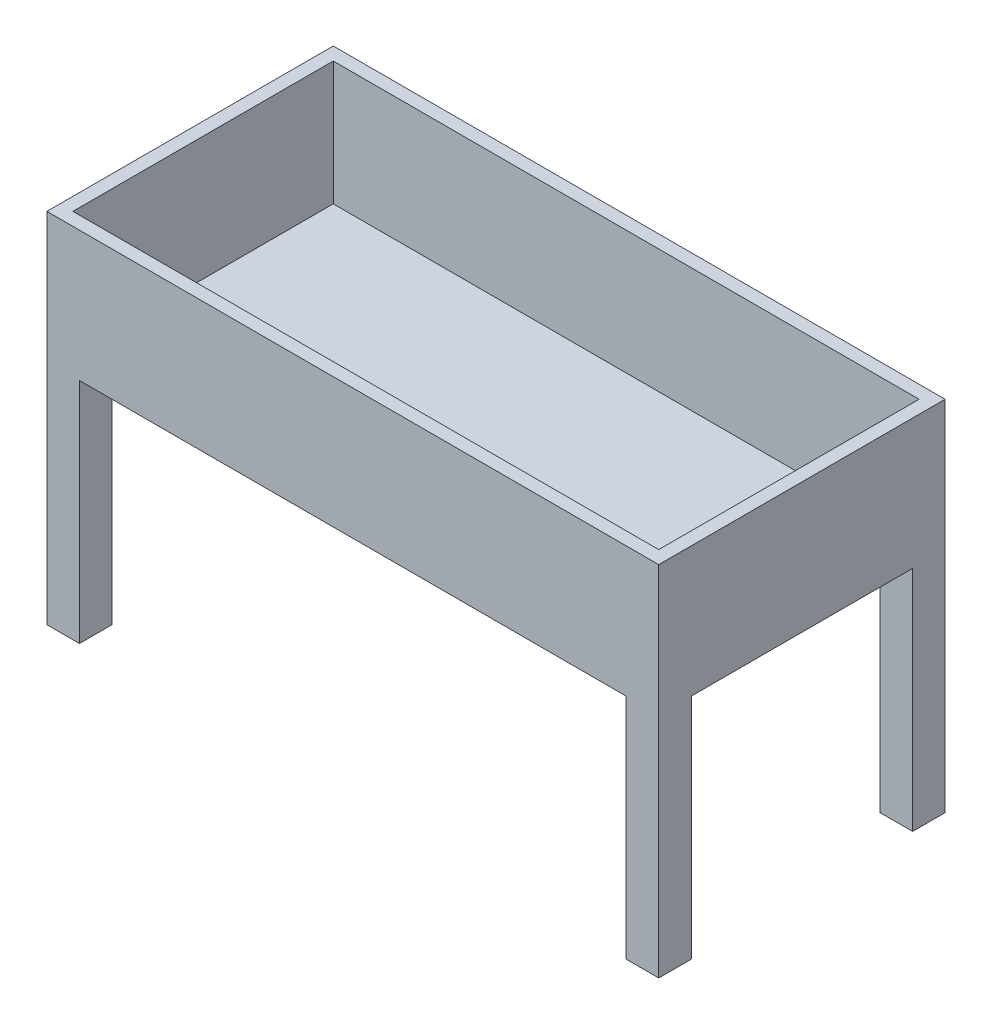
from build123d import *

# Parameters (mm, degrees)
SKETCH_1_W          = 94
SKETCH_1_H          = 44
EXTRUDE_2_DEPTH     = 20
SKETCH_2_W          = 90
SKETCH_2_H          = 40
CUT_EXTRUDE_1_DEPTH = 19
SKETCH_3_W          = 5
SKETCH_3_H          = 5
EXTRUDE_3_DEPTH     = 35


with BuildPart() as part:
    # 草图1 → 凸台-拉伸2 (new body)
    with BuildSketch(Plane(origin=(0, 0, 0), x_dir=(1, 0, 0), z_dir=(0, 1, 0))):
        with Locations((47, 22)):
            Rectangle(SKETCH_1_W, SKETCH_1_H)
    extrude(amount=EXTRUDE_2_DEPTH)

    # 草图2 → 切除-拉伸1 (cut)
    with BuildSketch(Plane(origin=(0, 20, 0), x_dir=(1, 0, 0), z_dir=(0, 1, 0))):
        with Locations((47, 22)):
            Rectangle(SKETCH_2_W, SKETCH_2_H)
    extrude(amount=-CUT_EXTRUDE_1_DEPTH, mode=Mode.SUBTRACT)

    # 草图3 → 凸台-拉伸3 (add)
    with BuildSketch(Plane.XZ):
        with Locations((2.5, -2.5)):
            Rectangle(SKETCH_3_W, SKETCH_3_H)
        with Locations((91.5, -2.5)):
            Rectangle(SKETCH_3_W, SKETCH_3_H)
        with Locations((91.5, -41.5)):
            Rectangle(SKETCH_3_W, SKETCH_3_H)
        with Locations((2.5, -41.5)):
            Rectangle(SKETCH_3_W, SKETCH_3_H)
    extrude(amount=EXTRUDE_3_DEPTH)


solid = part.part
